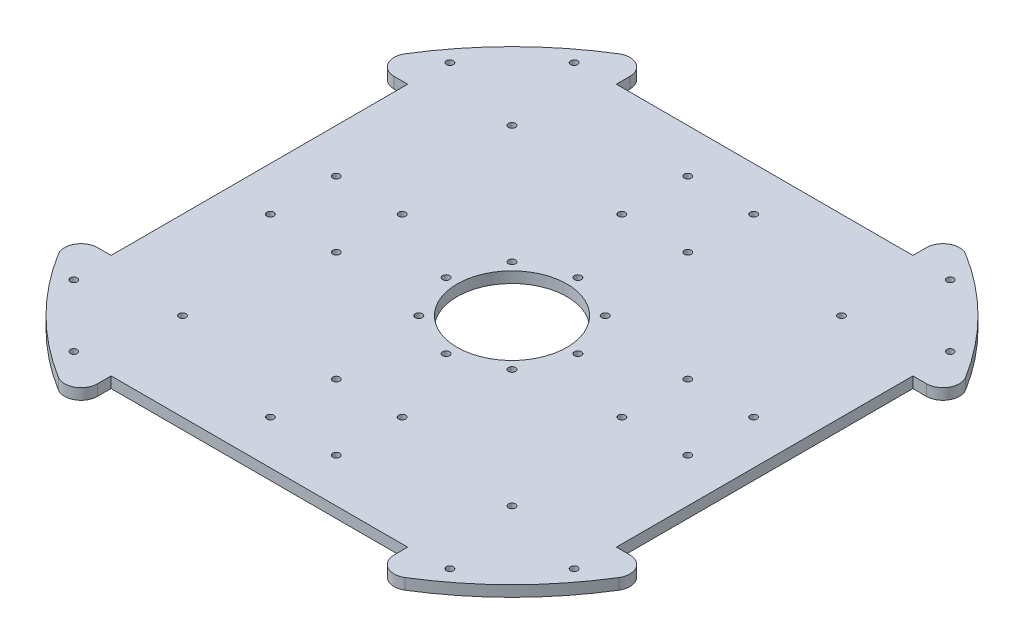
from build123d import *

# Parameters (mm, degrees)
BOSS_EXTRUDE1_DEPTH     = 5
FILLET1_R               = 7.5
CUT_EXTRUDE2_DEPTH      = 183.030179489
CUT_EXTRUDE2_DEPTH_BACK = 183.030179489
SKETCH3_R               = 1.6
CUT_EXTRUDE3_DEPTH      = 183.030179489
CUT_EXTRUDE3_DEPTH_BACK = 183.030179489
SKETCH4_R               = 25
SKETCH4_R_2             = 1.6
CUT_EXTRUDE4_DEPTH      = 183.030179489
CUT_EXTRUDE4_DEPTH_BACK = 183.030179489
SKETCH5_R               = 1.6
CUT_EXTRUDE5_DEPTH      = 183.030179489
CUT_EXTRUDE5_DEPTH_BACK = 183.030179489
SKETCH6_R               = 1.6


with BuildPart() as part:
    # Sketch1 → Boss-Extrude1 (new body)
    with BuildSketch(Plane(origin=(0, 0, 0), x_dir=(1, 0, 0), z_dir=(0, 1, 0))):
        with BuildLine():
            Line((115, 67.5), (133.954283246, 67.5))
            ThreePointArc((133.954283246, 67.5), (106.066017178, 106.066017178), (67.5, 133.954283246))
            Line((67.5, 133.954283246), (67.5, 115))
            Line((67.5, 115), (-67.5, 115))
            Line((-67.5, 115), (-67.5, 133.954283246))
            ThreePointArc((-67.5, 133.954283246), (-106.066017178, 106.066017178), (-133.954283246, 67.5))
            Line((-133.954283246, 67.5), (-115, 67.5))
            Line((-115, 67.5), (-115, -67.5))
            Line((-115, -67.5), (-133.954283246, -67.5))
            ThreePointArc((-133.954283246, -67.5), (-106.066017178, -106.066017178), (-67.5, -133.954283246))
            Line((-67.5, -133.954283246), (-67.5, -115))
            Line((-67.5, -115), (67.5, -115))
            Line((67.5, -115), (67.5, -133.954283246))
            ThreePointArc((67.5, -133.954283246), (106.066017178, -106.066017178), (133.954283246, -67.5))
            Line((133.954283246, -67.5), (115, -67.5))
            Line((115, -67.5), (115, 67.5))
        make_face()
    extrude(amount=BOSS_EXTRUDE1_DEPTH)

    # Fillet1
    fillet1_edges = [part.edges().sort_by_distance(p)[0] for p in [
        (-67.5, 2.5, 133.954283246),
        (-133.954283246, 2.5, 67.5),
        (-133.954283246, 2.5, -67.5),
        (-67.5, 2.5, -133.954283246),
        (67.5, 2.5, -133.954283246),
        (133.954283246, 2.5, -67.5),
        (133.954283246, 2.5, 67.5),
        (67.5, 2.5, 133.954283246),
    ]]
    fillet(fillet1_edges, radius=FILLET1_R)

    # Sketch3 → Cut-Extrude2 (cut, two sides: drawn at the far end of the back side and taken through both)
    with BuildSketch(Plane(origin=(0, 5, 0), x_dir=(1, 0, 0), z_dir=(0, 1, 0)).offset(-CUT_EXTRUDE2_DEPTH_BACK)):
        with Locations(Location((-15, -95, 0), (0, 0, 270))):
            Circle(SKETCH3_R)
        with Locations(Location((-15, -65, 0), (0, 0, 270))):
            Circle(SKETCH3_R)
        with Locations(Location((15, -65, 0), (0, 0, 270))):
            Circle(SKETCH3_R)
        with Locations(Location((15, -95, 0), (0, 0, 270))):
            Circle(SKETCH3_R)
        with Locations(Location((-65, 15, 0), (0, 0, 270))):
            Circle(SKETCH3_R)
        with Locations(Location((-65, -15, 0), (0, 0, 270))):
            Circle(SKETCH3_R)
        with Locations(Location((-95, -15, 0), (0, 0, 270))):
            Circle(SKETCH3_R)
        with Locations(Location((-95, 15, 0), (0, 0, 270))):
            Circle(SKETCH3_R)
        with Locations(Location((15, 65, 0), (0, 0, 270))):
            Circle(SKETCH3_R)
        with Locations(Location((-15, 65, 0), (0, 0, 270))):
            Circle(SKETCH3_R)
        with Locations(Location((-15, 95, 0), (0, 0, 270))):
            Circle(SKETCH3_R)
        with Locations(Location((15, 95, 0), (0, 0, 270))):
            Circle(SKETCH3_R)
        with Locations(Location((65, -15, 0), (0, 0, 270))):
            Circle(SKETCH3_R)
        with Locations(Location((65, 15, 0), (0, 0, 270))):
            Circle(SKETCH3_R)
        with Locations(Location((95, 15, 0), (0, 0, 270))):
            Circle(SKETCH3_R)
        with Locations(Location((95, -15, 0), (0, 0, 270))):
            Circle(SKETCH3_R)
    extrude(amount=CUT_EXTRUDE2_DEPTH + CUT_EXTRUDE2_DEPTH_BACK, mode=Mode.SUBTRACT)

    # Sketch4 → Cut-Extrude3 (cut, two sides: drawn at the far end of the back side and taken through both)
    with BuildSketch(Plane(origin=(0, 5, 0), x_dir=(1, 0, 0), z_dir=(0, 1, 0)).offset(-CUT_EXTRUDE3_DEPTH_BACK)):
        with Locations(Location((0, 0, 0), (0, 0, 270))):
            Circle(SKETCH4_R)
        with Locations(Location((0, 30, 0), (0, 0, 270))):
            Circle(SKETCH4_R_2)
        with Locations(Location((21.213203436, 21.213203436, 0), (0, 0, 270))):
            Circle(SKETCH4_R_2)
        with Locations(Location((30, 0, 0), (0, 0, 270))):
            Circle(SKETCH4_R_2)
        with Locations(Location((21.213203436, -21.213203436, 0), (0, 0, 270))):
            Circle(SKETCH4_R_2)
        with Locations(Location((0, -30, 0), (0, 0, 270))):
            Circle(SKETCH4_R_2)
        with Locations(Location((-21.213203436, -21.213203436, 0), (0, 0, 270))):
            Circle(SKETCH4_R_2)
        with Locations(Location((-30, 0, 0), (0, 0, 270))):
            Circle(SKETCH4_R_2)
        with Locations(Location((-21.213203436, 21.213203436, 0), (0, 0, 270))):
            Circle(SKETCH4_R_2)
    extrude(amount=CUT_EXTRUDE3_DEPTH + CUT_EXTRUDE3_DEPTH_BACK, mode=Mode.SUBTRACT)

    # Sketch5 → Cut-Extrude4 (cut, two sides: drawn at the far end of the back side and taken through both)
    with BuildSketch(Plane(origin=(0, 5, 0), x_dir=(1, 0, 0), z_dir=(0, 1, 0)).offset(-CUT_EXTRUDE4_DEPTH_BACK)):
        with Locations(Location((75, -75, 0), (0, 0, 270))):
            Circle(SKETCH5_R)
        with Locations(Location((-75, -75, 0), (0, 0, 270))):
            Circle(SKETCH5_R)
        with Locations(Location((75, 75, 0), (0, 0, 270))):
            Circle(SKETCH5_R)
        with Locations(Location((-75, 75, 0), (0, 0, 270))):
            Circle(SKETCH5_R)
    extrude(amount=CUT_EXTRUDE4_DEPTH + CUT_EXTRUDE4_DEPTH_BACK, mode=Mode.SUBTRACT)

    # Sketch6 → Cut-Extrude5 (cut, two sides: drawn at the far end of the back side and taken through both)
    with BuildSketch(Plane(origin=(0, 5, 0), x_dir=(1, 0, 0), z_dir=(0, 1, 0)).offset(-CUT_EXTRUDE5_DEPTH_BACK)):
        with Locations(Location((-113.890872965, -85.606601718, 0), (0, 0, 270))):
            Circle(SKETCH6_R)
        with Locations(Location((-85.606601718, -113.890872965, 0), (0, 0, 270))):
            Circle(SKETCH6_R)
        with Locations(Location((-113.890872965, 85.606601718, 0), (0, 0, 270))):
            Circle(SKETCH6_R)
        with Locations(Location((-85.606601718, 113.890872965, 0), (0, 0, 270))):
            Circle(SKETCH6_R)
        with Locations(Location((85.606601718, 113.890872965, 0), (0, 0, 270))):
            Circle(SKETCH6_R)
        with Locations(Location((113.890872965, 85.606601718, 0), (0, 0, 270))):
            Circle(SKETCH6_R)
        with Locations(Location((113.890872965, -85.606601718, 0), (0, 0, 270))):
            Circle(SKETCH6_R)
        with Locations(Location((85.606601718, -113.890872965, 0), (0, 0, 270))):
            Circle(SKETCH6_R)
    extrude(amount=CUT_EXTRUDE5_DEPTH + CUT_EXTRUDE5_DEPTH_BACK, mode=Mode.SUBTRACT)


solid = part.part
